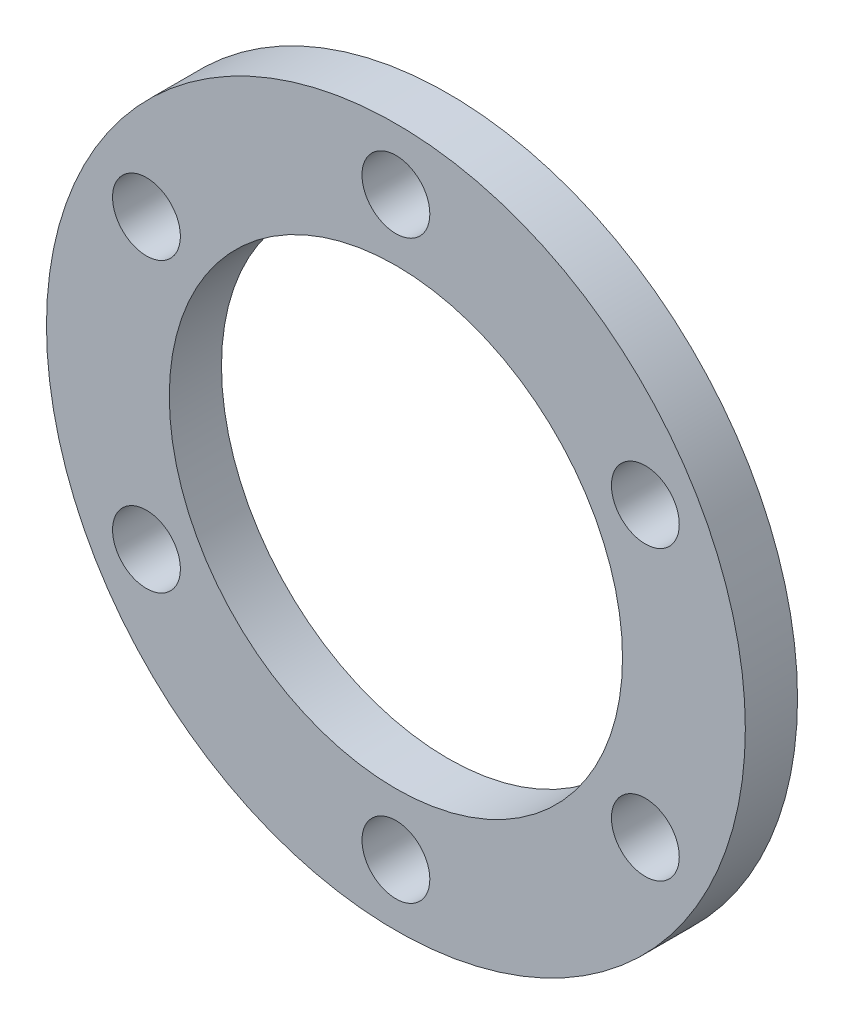
from build123d import *

# Parameters (mm, degrees)
SKETCH1_R           = 28.9052
SKETCH1_R_2         = 2.8067
SKETCH1_R_3         = 18.7452
BOSS_EXTRUDE1_DEPTH = 4.318


with BuildPart() as part:
    # Sketch1 → Boss-Extrude1 (new body)
    with BuildSketch(Plane.XY):
        Circle(SKETCH1_R)
        with Locations((0, 23.8252)):
            Circle(SKETCH1_R_2, mode=Mode.SUBTRACT)
        with Locations((20.63322845, 11.9126)):
            Circle(SKETCH1_R_2, mode=Mode.SUBTRACT)
        with Locations((20.63322845, -11.9126)):
            Circle(SKETCH1_R_2, mode=Mode.SUBTRACT)
        with Locations((0, -23.8252)):
            Circle(SKETCH1_R_2, mode=Mode.SUBTRACT)
        with Locations((-20.63322845, -11.9126)):
            Circle(SKETCH1_R_2, mode=Mode.SUBTRACT)
        with Locations((-20.63322845, 11.9126)):
            Circle(SKETCH1_R_2, mode=Mode.SUBTRACT)
        Circle(SKETCH1_R_3, mode=Mode.SUBTRACT)
    extrude(amount=BOSS_EXTRUDE1_DEPTH)


solid = part.part
